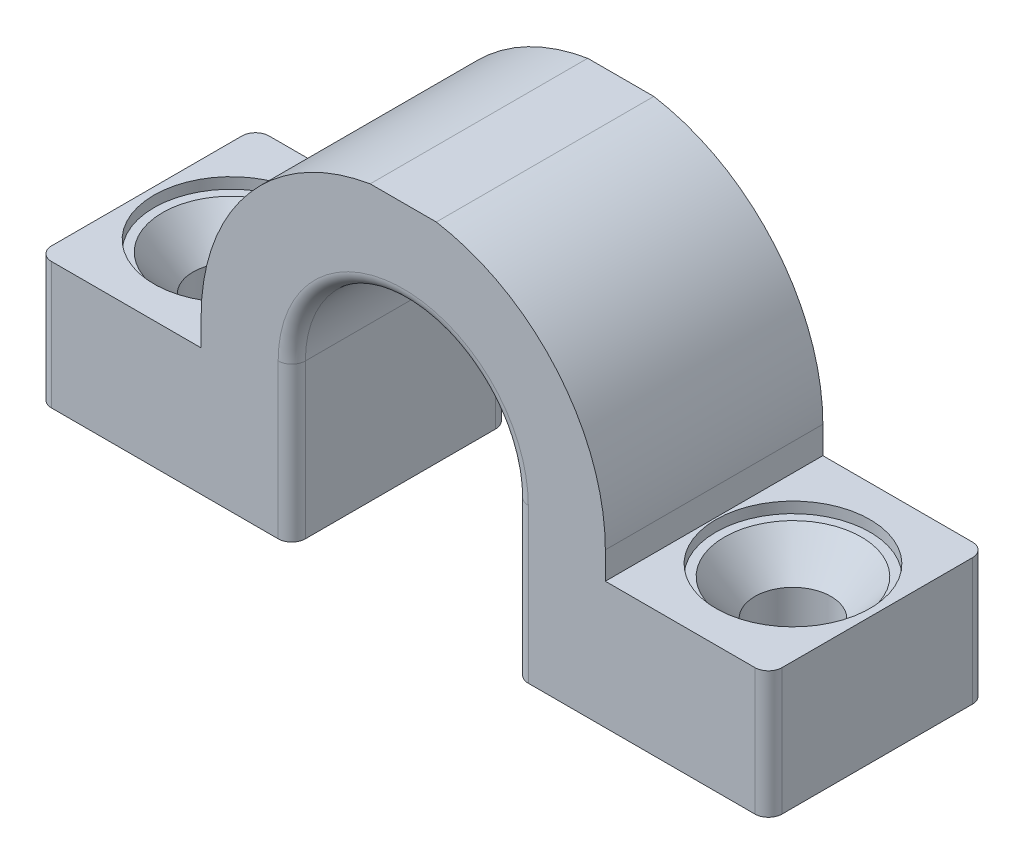
from build123d import *
from OCP.BRepFilletAPI import BRepFilletAPI_MakeChamfer

# Parameters (mm, degrees)
BOSS_EXTRUDE1_DEPTH = 12
SKETCH4_R           = 2.1
CUT_EXTRUDE1_DEPTH  = 27.646669586
SKETCH5_W           = 17.126081539
SKETCH5_H           = 14.483771816
CUT_EXTRUDE2_DEPTH  = 31.50036885
FILLET2_R           = 0.75
SKETCH7_R           = 4.25
CUT_EXTRUDE4_DEPTH  = 0.6
CHAMFER1_SIZE       = 2
CHAMFER1_SIZE2      = 1.678199262


with BuildPart() as part:
    # Sketch1 → Boss-Extrude1 (new body)
    with BuildSketch(Plane.XY):
        with BuildLine():
            Line((-11.15, 0), (-11.15, -1.5))
            Line((-11.15, -1.5), (-20.15, -1.5))
            Line((-20.15, -1.5), (-20.15, -8.5))
            Line((-20.15, -8.5), (-6.15, -8.5))
            Line((-6.15, -8.5), (-6.15, 0))
            ThreePointArc((-6.15, 0), (0, 6.15), (6.15, 0))
            Line((6.15, 0), (6.15, -8.5))
            Line((6.15, -8.5), (20.15, -8.5))
            Line((20.15, -8.5), (20.15, -1.5))
            Line((20.15, -1.5), (11.15, -1.5))
            Line((11.15, -1.5), (11.15, 0))
            ThreePointArc((11.15, 0), (0, 11.15), (-11.15, 0))
        make_face()
    extrude(amount=BOSS_EXTRUDE1_DEPTH)

    # Sketch4 → Cut-Extrude1 (cut, through all)
    with BuildSketch(Plane(origin=(0, -1.5, 0), x_dir=(1, 0, 0), z_dir=(0, 1, 0))):
        with Locations(Location((-15.5, -6, 0), (0, 0, 180))):
            Circle(SKETCH4_R)
        with Locations(Location((15.5, -6, 0), (0, 0, 180))):
            Circle(SKETCH4_R)
    extrude(amount=-CUT_EXTRUDE1_DEPTH, mode=Mode.SUBTRACT)

    # Sketch5 → Cut-Extrude2 (cut, through all)
    with BuildSketch(Plane(origin=(0, 11, 0), x_dir=(1, 0, 0), z_dir=(0, 1, 0))):
        with Locations((0.195726647, -5.794276843)):
            Rectangle(SKETCH5_W, SKETCH5_H)
    extrude(amount=CUT_EXTRUDE2_DEPTH, mode=Mode.SUBTRACT)

    # Fillet2
    fillet2_edges = [part.edges().sort_by_distance(p)[0] for p in [
        (20.15, -5, 0),
        (6.15, -4.25, 0),
        (0, 6.15, 0),
        (-6.15, -4.25, 0),
        (-20.15, -5, 0),
        (-20.15, -5, 12),
        (-6.15, -4.25, 12),
        (0, 6.15, 12),
        (6.15, -4.25, 12),
        (20.15, -5, 12),
    ]]
    fillet(fillet2_edges, radius=FILLET2_R)

    # Sketch7 → Cut-Extrude4 (cut)
    with BuildSketch(Plane(origin=(0, -1.5, 0), x_dir=(1, 0, 0), z_dir=(0, 1, 0))):
        with Locations(Location((-15.5, -6, 0), (0, 0, 180))):
            Circle(SKETCH7_R)
        with Locations(Location((15.5, -6, 0), (0, 0, 180))):
            Circle(SKETCH7_R)
    extrude(amount=-CUT_EXTRUDE4_DEPTH, mode=Mode.SUBTRACT)

    # Chamfer1: one chamfer whose edges measure the first distance from different faces: ONE call of the kernel's chamfer builder (chamfer() names one face for all edges)
    chamfer1_edges_1 = [part.edges().sort_by_distance(p)[0] for p in [
        (-13.4, -2.1, 6),
    ]]
    chamfer1_side_1 = [part.faces().sort_by_distance(p)[0] for p in [
        (-13.4, -5.3, 6),
    ]]
    chamfer1_edges_2 = [part.edges().sort_by_distance(p)[0] for p in [
        (17.6, -2.1, 6),
    ]]
    chamfer1_side_2 = [part.faces().sort_by_distance(p)[0] for p in [
        (17.6, -5.3, 6),
    ]]
    chamfer1 = BRepFilletAPI_MakeChamfer(part.part.solid().wrapped)
    for e in chamfer1_edges_1:
        chamfer1.Add(CHAMFER1_SIZE, CHAMFER1_SIZE2, e.wrapped, chamfer1_side_1[0].wrapped)  # the first distance lies on this face
    for e in chamfer1_edges_2:
        chamfer1.Add(CHAMFER1_SIZE, CHAMFER1_SIZE2, e.wrapped, chamfer1_side_2[0].wrapped)  # the first distance lies on this face
    add(Compound.cast(chamfer1.Shape()), mode=Mode.REPLACE)


solid = part.part
